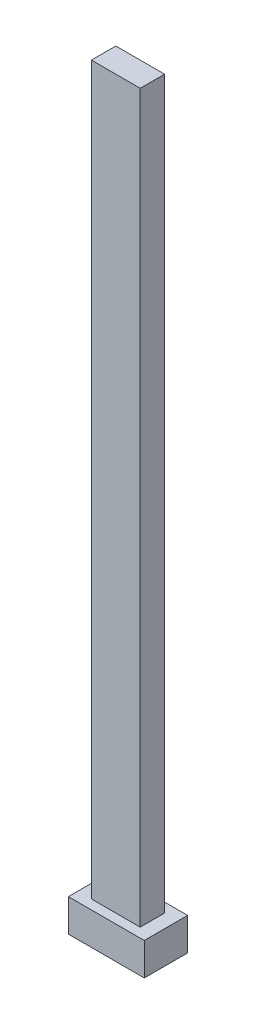
from build123d import *

# Parameters (mm, degrees)
SKETCH1_W           = 7
SKETCH1_H           = 4
SKETCH1_W_2         = 4.5
SKETCH1_H_2         = 2.25
BOSS_EXTRUDE1_DEPTH = 3
SKETCH1_2_W         = 4.5
SKETCH1_2_H         = 2.25
BOSS_EXTRUDE2_DEPTH = 70


with BuildPart() as part:
    # Sketch1 → Boss-Extrude1 (new body)
    with BuildSketch(Plane(origin=(0, 0, 0), x_dir=(1, 0, 0), z_dir=(0, 1, 0))):
        Rectangle(SKETCH1_W, SKETCH1_H)
        Rectangle(SKETCH1_W_2, SKETCH1_H_2, mode=Mode.SUBTRACT)
    extrude(amount=BOSS_EXTRUDE1_DEPTH)

    # Sketch1<2> → Boss-Extrude2 (add)
    with BuildSketch(Plane(origin=(0, 0, 0), x_dir=(1, 0, 0), z_dir=(0, 1, 0))):
        Rectangle(SKETCH1_2_W, SKETCH1_2_H)
    extrude(amount=BOSS_EXTRUDE2_DEPTH)


solid = part.part
